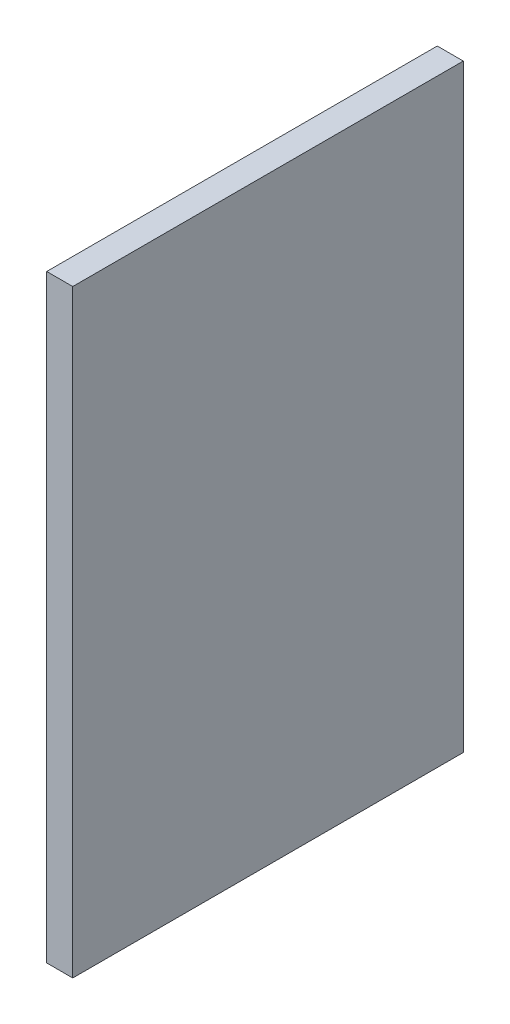
from build123d import *

# Parameters (mm, degrees)
SKETCH1_W           = 12.7
SKETCH1_H           = 190.5
BOSS_EXTRUDE1_DEPTH = 292.1


with BuildPart() as part:
    # Sketch1 → Boss-Extrude1 (new body)
    with BuildSketch(Plane(origin=(0, 0, 0), x_dir=(1, 0, 0), z_dir=(0, 1, 0))):
        with Locations((6.35, 95.25)):
            Rectangle(SKETCH1_W, SKETCH1_H)
    extrude(amount=BOSS_EXTRUDE1_DEPTH)


solid = part.part
